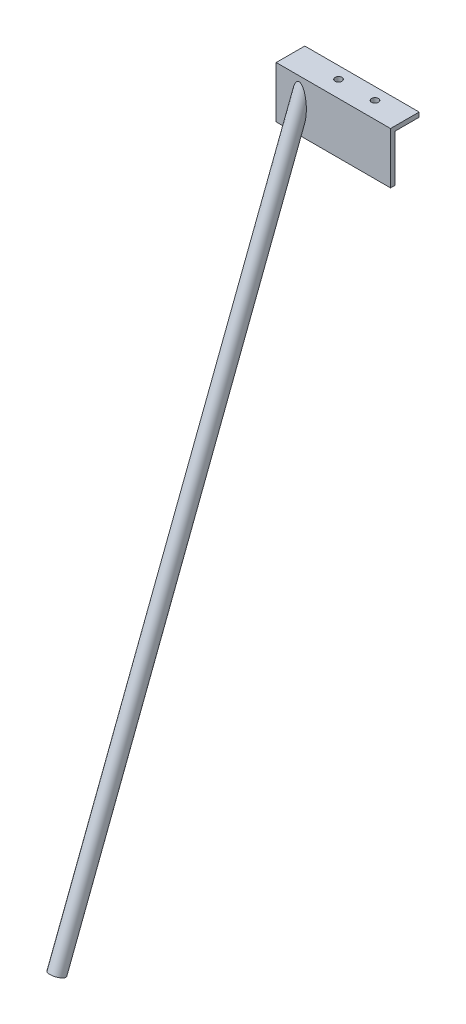
from build123d import *

# Parameters (mm, degrees)
BOSS_EXTRUDE1_DEPTH             = 100
BOSS_EXTRUDE2_REACH             = 116.642
SKETCH2_R                       = 6.375
SKETCH2_R_2                     = 4.9
BOSS_EXTRUDE2_DIRECTION_2_DEPTH = 570
F_6_0MM_DOWEL_HOLE1_D           = 6


with BuildPart() as part:
    # Sketch1 → Boss-Extrude1 (new body)
    with BuildSketch(Plane(origin=(0, 0, 0), x_dir=(0, 0, -1), z_dir=(1, 0, 0))):
        Polygon((0, 0), (25, 0), (25, -4), (4, -4), (4, -45), (0, -45), align=None)
    extrude(amount=BOSS_EXTRUDE1_DEPTH)

    # Boss-Extrude2: up to this plane
    boss_extrude2_end = Plane(origin=(100, -45, 0), z_dir=(0, 0, -1))
    # Sketch2 → Boss-Extrude2 (add, up to the surface)
    with BuildSketch(Plane(origin=(0, -39.220758573, 15.055438643), x_dir=(-1, 0, 0), z_dir=(0, 0.9335804264972002, -0.3583679495453042)), mode=Mode.PRIVATE) as boss_extrude2_sk1:
        with Locations((-20, -8)):
            Circle(SKETCH2_R)
        with Locations((-20, -8)):
            Circle(SKETCH2_R_2, mode=Mode.SUBTRACT)
    boss_extrude2_tool1 = split(extrude(boss_extrude2_sk1.sketch, amount=BOSS_EXTRUDE2_REACH, mode=Mode.PRIVATE), bisect_by=boss_extrude2_end, keep=Keep.BOTH, mode=Mode.PRIVATE)
    add(boss_extrude2_tool1.solids().sort_by_distance((26.194688, -42.087702, 7.586795))[0])

    # Sketch2 → Boss-Extrude2 direction 2 (add)
    with BuildSketch(Plane(origin=(0, -39.220758573, 15.055438643), x_dir=(-1, 0, 0), z_dir=(0, 0.9335804264972002, -0.3583679495453042))):
        with Locations((-20, -8)):
            Circle(SKETCH2_R)
        with Locations((-20, -8)):
            Circle(SKETCH2_R_2, mode=Mode.SUBTRACT)
    extrude(amount=-BOSS_EXTRUDE2_DIRECTION_2_DEPTH)

    # Ø6.0mm Dowel Hole1 (through all)
    with Locations(Plane(origin=(0, 0, 0), x_dir=(1, 0, 0), z_dir=(0, 1, 0))):
        with Locations((40, 14.5), (71.89, 14.5)):
            Hole(F_6_0MM_DOWEL_HOLE1_D / 2)


solid = part.part
